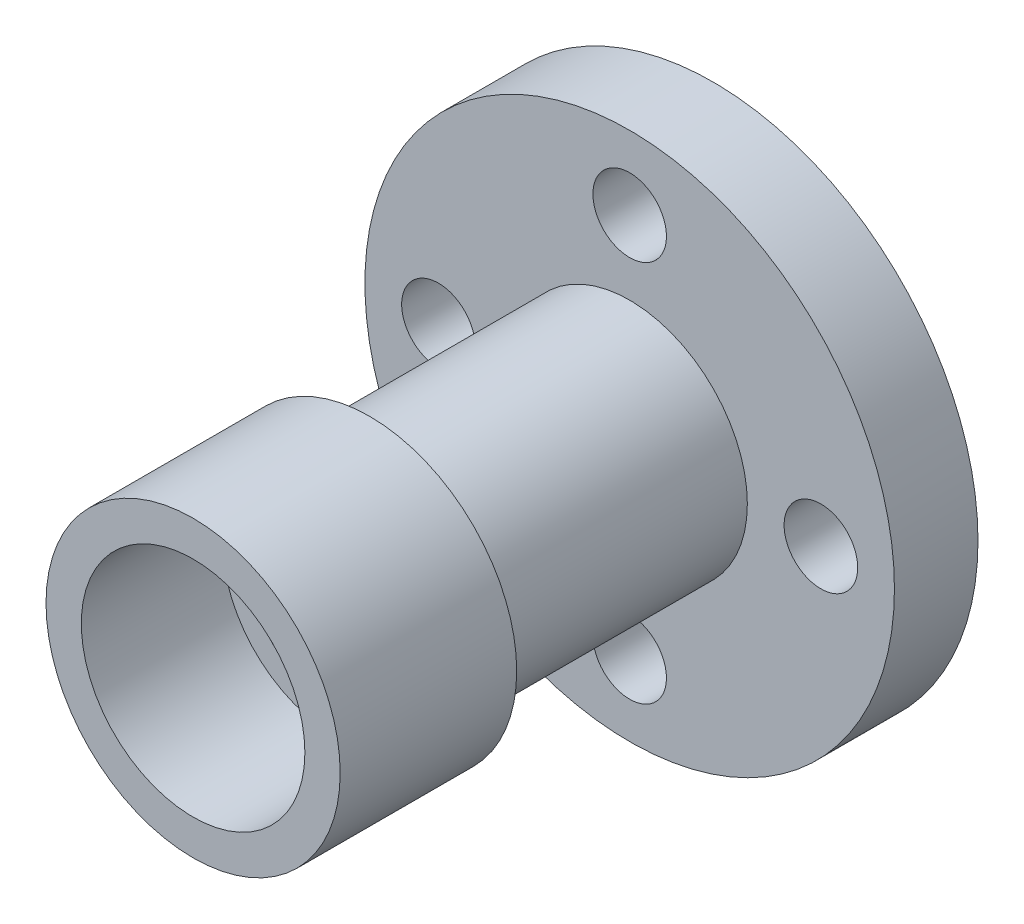
from build123d import *

# Parameters (mm, degrees)
CROQUIS2_R              = 45
SALIENTE_EXTRUIR1_DEPTH = 14.2
CROQUIS3_R              = 20
SALIENTE_EXTRUIR2_DEPTH = 44.2
CROQUIS4_R              = 15
CORTAR_EXTRUIR1_DEPTH   = 85.2
CROQUIS5_R              = 25
SALIENTE_EXTRUIR3_DEPTH = 30
CROQUIS6_R              = 19
CORTAR_EXTRUIR2_DEPTH   = 24
CROQUIS7_R              = 15
CORTAR_EXTRUIR3_DEPTH   = 6
CHAFL_N1_SIZE           = 3.5
CHAFL_N1_SIZE2          = 3
CROQUIS8_R              = 6.25
CORTAR_EXTRUIR4_DEPTH   = 14.2


with BuildPart() as part:
    # Croquis2 → Saliente-Extruir1 (new body)
    with BuildSketch(Plane.XY):
        Circle(CROQUIS2_R)
    extrude(amount=SALIENTE_EXTRUIR1_DEPTH)

    # Croquis3 → Saliente-Extruir2 (add)
    with BuildSketch(Plane.XY.offset(14.2)):
        Circle(CROQUIS3_R)
    extrude(amount=SALIENTE_EXTRUIR2_DEPTH)

    # Croquis4 → Cortar-Extruir1 (cut)
    with BuildSketch(Plane.XY.offset(58.4)):
        Circle(CROQUIS4_R)
    extrude(amount=-CORTAR_EXTRUIR1_DEPTH, mode=Mode.SUBTRACT)

    # Croquis5 → Saliente-Extruir3 (add)
    with BuildSketch(Plane.XY.offset(58.4)):
        Circle(CROQUIS5_R)
    extrude(amount=SALIENTE_EXTRUIR3_DEPTH)

    # Croquis6 → Cortar-Extruir2 (cut)
    with BuildSketch(Plane.XY.offset(88.4)):
        Circle(CROQUIS6_R)
    extrude(amount=-CORTAR_EXTRUIR2_DEPTH, mode=Mode.SUBTRACT)

    # Croquis7 → Cortar-Extruir3 (cut)
    with BuildSketch(Plane.XY.offset(64.4)):
        Circle(CROQUIS7_R)
    extrude(amount=-CORTAR_EXTRUIR3_DEPTH, mode=Mode.SUBTRACT)

    # Chaflán1
    chafl_n1_edges = [part.edges().sort_by_distance(p)[0] for p in [
        (-15, 0, 0),
    ]]
    chafl_n1_side = [part.faces().sort_by_distance(p)[0] for p in [
        (-15, 0, 32.2),
    ]]
    chamfer(chafl_n1_edges, length=CHAFL_N1_SIZE, length2=CHAFL_N1_SIZE2, reference=chafl_n1_side[0])

    # Croquis8 → Cortar-Extruir4 (cut)
    with BuildSketch(Plane.XY.offset(14.2)):
        with Locations((0, 32.5)):
            Circle(CROQUIS8_R)
        with Locations((32.5, 0)):
            Circle(CROQUIS8_R)
        with Locations((0, -32.5)):
            Circle(CROQUIS8_R)
        with Locations((-32.5, 0)):
            Circle(CROQUIS8_R)
    extrude(amount=-CORTAR_EXTRUIR4_DEPTH, mode=Mode.SUBTRACT)


solid = part.part
